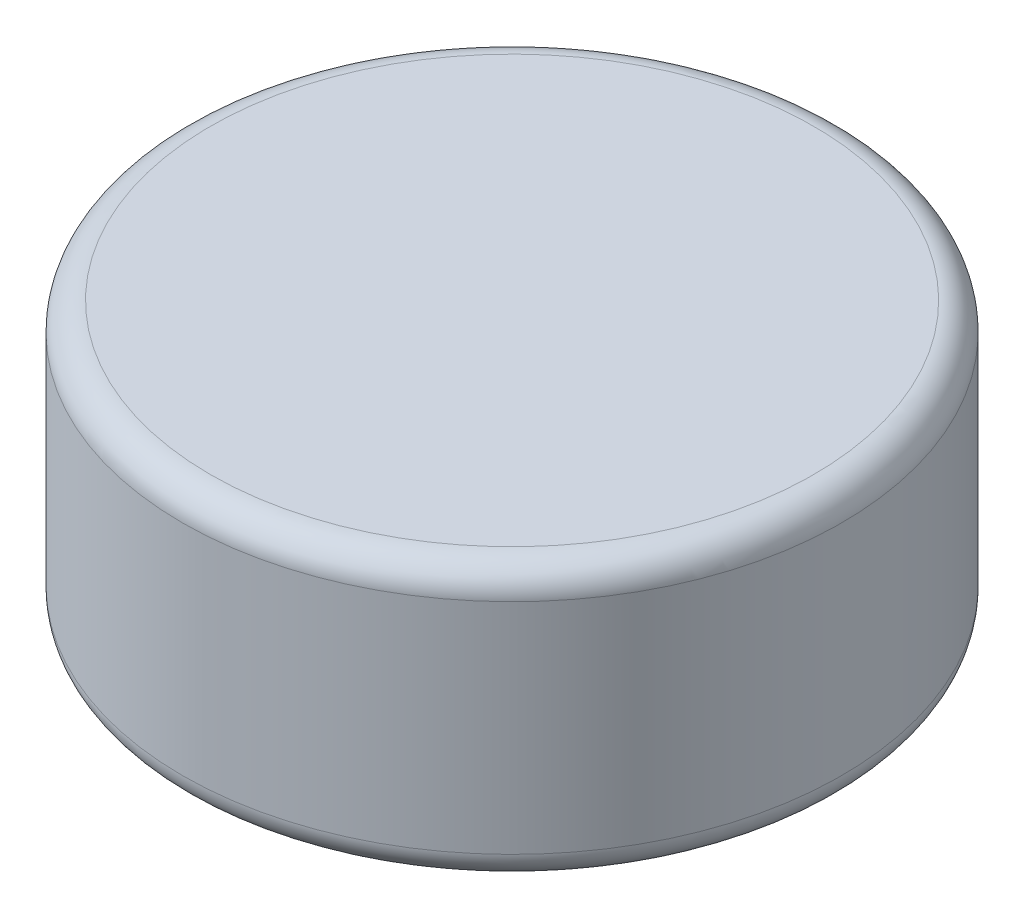
from build123d import *

# Parameters (mm, degrees)
SKETCH1_R           = 3
BOSS_EXTRUDE1_DEPTH = 2.5
FILLET1_R           = 0.254


with BuildPart() as part:
    # Sketch1 → Boss-Extrude1 (new body)
    with BuildSketch(Plane(origin=(0, 0, 0), x_dir=(1, 0, 0), z_dir=(0, 1, 0))):
        with Locations(Location((0, 0, 0), (0, 0, 270))):
            Circle(SKETCH1_R)
    extrude(amount=BOSS_EXTRUDE1_DEPTH)

    # Fillet1
    fillet1_edges = [part.edges().sort_by_distance(p)[0] for p in [
        (0, 0, -3),
        (0, 2.5, -3),
    ]]
    fillet(fillet1_edges, radius=FILLET1_R)


solid = part.part
